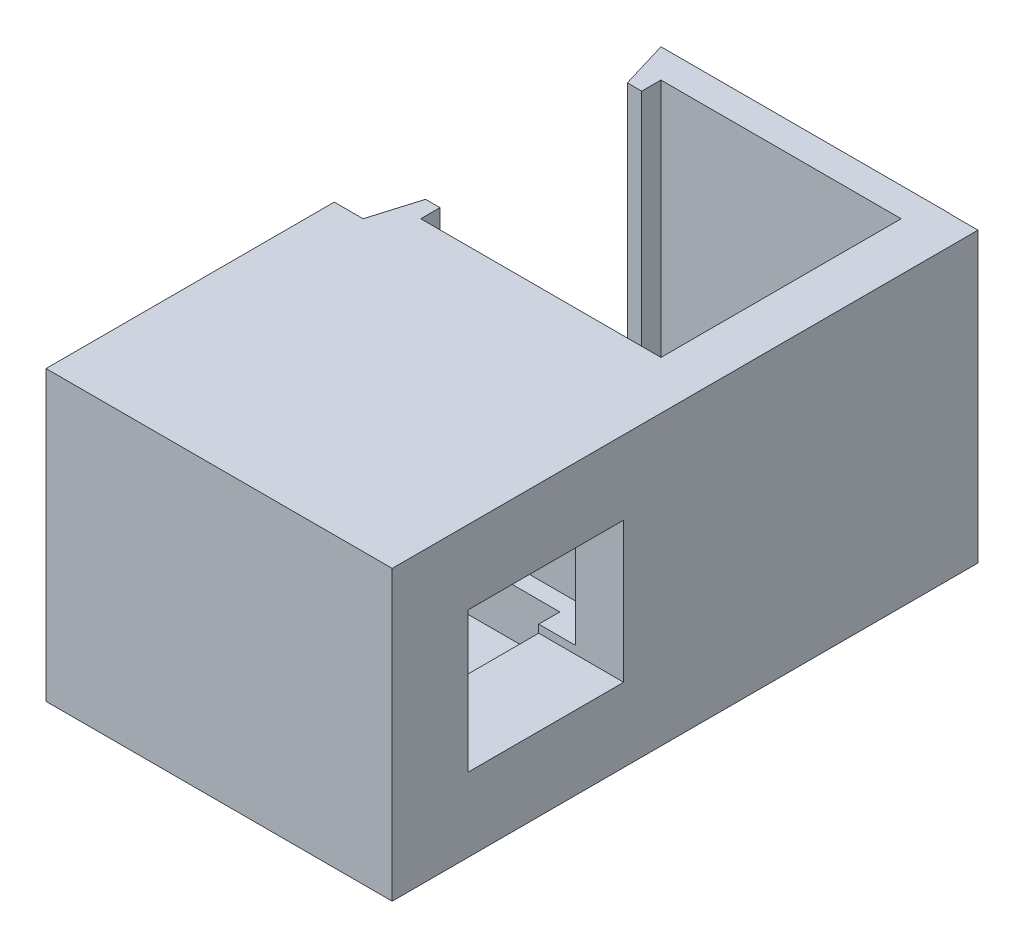
from build123d import *

# Parameters (mm, degrees)
EXTRUDE_1_DEPTH      = 30
CUT_EXTRUDE_4_DEPTH  = 82.16997337
SKETCH_7_W           = 16.60831278
SKETCH_7_H           = 38.473598513
CUT_EXTRUDE_14_DEPTH = 82.16997337
SKETCH_8_W           = 5
SKETCH_8_H           = 30.968526609
EXTRUDE_2_DEPTH      = 30
SKETCH_9_W           = 33.026813651
SKETCH_9_H           = 30
EXTRUDE_3_DEPTH      = 30
SKETCH_10_W          = 16.2
SKETCH_10_H          = 14.625
CUT_EXTRUDE_15_DEPTH = 57.68909173
SKETCH_11_W          = 23.4
SKETCH_11_H          = 23
CUT_EXTRUDE_16_DEPTH = 24.17681365
SKETCH_13_W          = 3.4
SKETCH_13_H          = 14.625
CUT_EXTRUDE_17_DEPTH = 1.5
EXTRUDE_4_DEPTH      = 5.5
SKETCH_15_W          = 4
SKETCH_15_H          = 13
CUT_EXTRUDE_18_DEPTH = 28.02681365
SKETCH_16_W          = 4
SKETCH_16_H          = 13
CUT_EXTRUDE_19_DEPTH = 1.5
SKETCH_17_W          = 30
SKETCH_17_H          = 30
EXTRUDE_5_DEPTH      = 3


with BuildPart() as part:
    # Эскиз1 → Бобышка-Вытянуть1 (new body)
    with BuildSketch(Plane(origin=(0, 0, 0), x_dir=(1, 0, 0), z_dir=(0, 1, 0))):
        Polygon((-66.825757576, 34.969739794), (-66.825757576, 29.969739794), (-63.825757576, 29.969739794), (-63.825757576, 31.969739794), (-38.825757576, 31.969739794), (-38.825757576, 6.969739794), (-63.825757576, 6.969739794), (-63.825757576, 8.969739794), (-66.825757576, 8.969739794), (-66.825757576, 3.969739794), (-22.123470102, 3.969739794), (-36.579007505, 34.969739794), align=None)
    extrude(amount=EXTRUDE_1_DEPTH)

    # Эскиз3 → Вырез-Вытянуть4 (cut, through all)
    with BuildSketch(Plane.XZ):
        Polygon((-66.825757576, -3.969739794), (-65.325757576, -8.969739794), (-66.825757576, -8.969739794), align=None)
        Polygon((-66.825757576, -29.969739794), (-66.825757576, -34.969739794), (-65.325757576, -29.969739794), align=None)
    extrude(amount=-CUT_EXTRUDE_4_DEPTH, mode=Mode.SUBTRACT)

    # Эскиз7 → Вырез-Вытянуть14 (cut, through all)
    with BuildSketch(Plane(origin=(0, 0, 0), x_dir=(-1, 0, 0), z_dir=(0, -1, 0))):
        with Locations((27.703474463, 20.539743139)):
            Rectangle(SKETCH_7_W, SKETCH_7_H)
    extrude(amount=-CUT_EXTRUDE_14_DEPTH, mode=Mode.SUBTRACT)

    # Эскиз8 → Бобышка-Вытянуть2 (add)
    with BuildSketch(Plane(origin=(0, 0, 0), x_dir=(-1, 0, 0), z_dir=(0, -1, 0))):
        with Locations((36.298943925, 19.454003098)):
            Rectangle(SKETCH_8_W, SKETCH_8_H)
    extrude(amount=-EXTRUDE_2_DEPTH)

    # Эскиз9 → Бобышка-Вытянуть3 (add)
    with BuildSketch(Plane.XY.offset(-3.969739794)):
        with Locations((-50.312350751, 15)):
            Rectangle(SKETCH_9_W, SKETCH_9_H)
    extrude(amount=EXTRUDE_3_DEPTH)

    # Эскиз10 → Вырез-Вытянуть15 (cut, through all)
    with BuildSketch(Plane(origin=(-33.798943925, 0, 0), x_dir=(0, 0, -1), z_dir=(1, 0, 0))):
        with Locations((-10.030260206, 14.9975)):
            Rectangle(SKETCH_10_W, SKETCH_10_H)
    extrude(amount=-CUT_EXTRUDE_15_DEPTH, mode=Mode.SUBTRACT)

    # Эскиз11 → Вырез-Вытянуть16 (cut)
    with BuildSketch(Plane.ZY.offset(66.825757576)):
        with Locations((11.430260206, 15)):
            Rectangle(SKETCH_11_W, SKETCH_11_H)
    extrude(amount=-CUT_EXTRUDE_16_DEPTH, mode=Mode.SUBTRACT)

    # Эскиз13 → Вырез-Вытянуть17 (cut)
    with BuildSketch(Plane(origin=(0, 0, 18.130260206), x_dir=(-1, 0, 0), z_dir=(0, 0, -1))):
        with Locations((40.498943925, 14.9975)):
            Rectangle(SKETCH_13_W, SKETCH_13_H)
    extrude(amount=-CUT_EXTRUDE_17_DEPTH, mode=Mode.SUBTRACT)

    # Эскиз14 → Бобышка-Вытянуть4 (add)
    with BuildSketch(Plane.ZY.offset(42.648943925)):
        Polygon((18.130260206, 22.31), (18.130260206, 26.5), (23.130260206, 26.5), (23.130260206, 3.5), (18.130260206, 3.5), (18.130260206, 7.685), align=None)
    extrude(amount=EXTRUDE_4_DEPTH)

    # Эскиз15 → Вырез-Вытянуть18 (cut)
    with BuildSketch(Plane.ZY.offset(66.825757576)):
        with Locations((-0.069739794, 15)):
            Rectangle(SKETCH_15_W, SKETCH_15_H)
    extrude(amount=-CUT_EXTRUDE_18_DEPTH, mode=Mode.SUBTRACT)

    # Эскиз16 → Вырез-Вытянуть19 (cut)
    with BuildSketch(Plane.XY.offset(-2.069739794)):
        with Locations((-40.798943925, 15)):
            Rectangle(SKETCH_16_W, SKETCH_16_H)
    extrude(amount=-CUT_EXTRUDE_19_DEPTH, mode=Mode.SUBTRACT)

    # Эскиз17 → Бобышка-Вытянуть5 (add)
    with BuildSketch(Plane.ZY.offset(66.825757576)):
        with Locations((11.030260206, 15)):
            Rectangle(SKETCH_17_W, SKETCH_17_H)
        Polygon((-0.269739794, 26.5), (23.130260206, 26.5), (23.130260206, 3.5), (-0.269739794, 3.5), (-0.269739794, 8.5), (-2.069739794, 8.5), (-2.069739794, 21.5), (-0.269739794, 21.5), align=None, mode=Mode.SUBTRACT)
    extrude(amount=EXTRUDE_5_DEPTH)


solid = part.part
